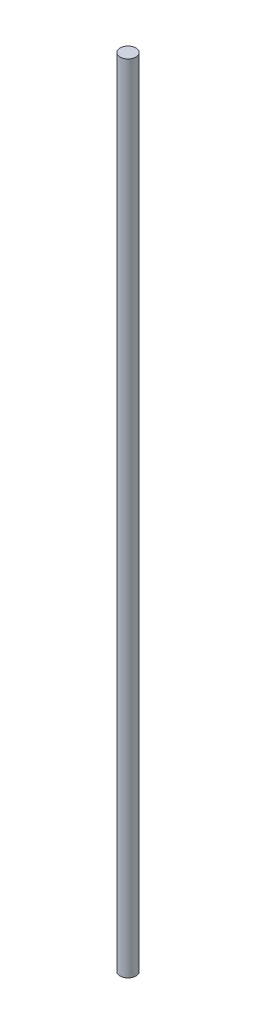
from build123d import *

# Parameters (mm, degrees)
SKETCH1_R           = 1.5
BOSS_EXTRUDE1_DEPTH = 150


with BuildPart() as part:
    # Sketch1 → Boss-Extrude1 (new body)
    with BuildSketch(Plane(origin=(0, 0, 0), x_dir=(1, 0, 0), z_dir=(0, 1, 0))):
        with Locations(Location((0, 0, 0), (0, 0, 270))):
            Circle(SKETCH1_R)
    extrude(amount=BOSS_EXTRUDE1_DEPTH)


solid = part.part
